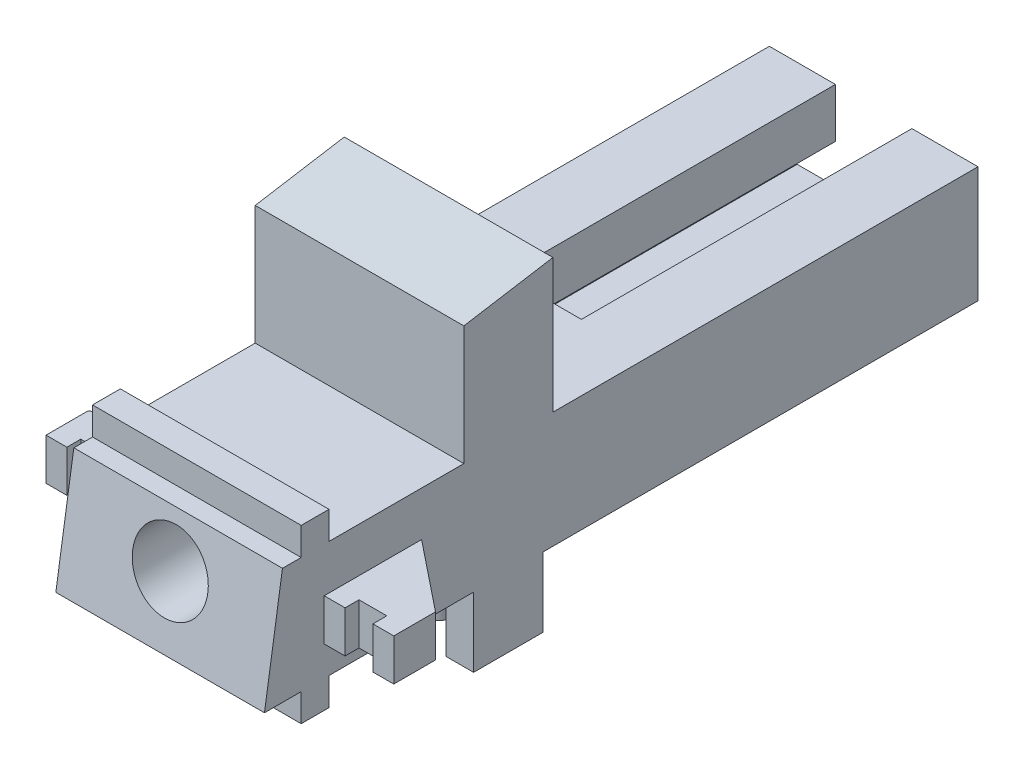
from build123d import *

# Parameters (mm, degrees)
SKETCH9_W               = 15
SKETCH9_H               = 8.35
BOSS_EXTRUDE4_DEPTH     = 50
CUT_EXTRUDE4_DEPTH      = 23.76
BOSS_EXTRUDE9_DEPTH     = 15
CUT_EXTRUDE5_REACH      = 31.734
SKETCH10_R              = 2.7
SKETCH12_W              = 3
SKETCH12_H              = 3
BOSS_EXTRUDE5_DEPTH     = 5
SKETCH13_W              = 2
SKETCH13_H              = 3
CUT_EXTRUDE6_DEPTH      = 1
BOSS_EXTRUDE6_DEPTH     = 3
SKETCH22_W              = 2
SKETCH22_H              = 2
BOSS_EXTRUDE10_DEPTH    = 15
CUT_EXTRUDE7_REACH      = 55.801
CUT_EXTRUDE7_END_RADIUS = 2.7
SKETCH23_R              = 2.5
SKETCH24_W              = 2
SKETCH24_H              = 5
BOSS_EXTRUDE11_DEPTH    = 5
BOSS_EXTRUDE12_DEPTH    = 15


with BuildPart() as part:
    # Sketch9 → Boss-Extrude4 (new body)
    with BuildSketch(Plane.XY):
        with Locations((0, 4.175)):
            Rectangle(SKETCH9_W, SKETCH9_H)
    extrude(amount=BOSS_EXTRUDE4_DEPTH)

    # Sketch7 → Cut-Extrude4 (cut)
    with BuildSketch(Plane.XY):
        Polygon((-5.5, 2), (-5.5, 4.8), (-2.75, 4.8), (-2.75, 8.35), (2.75, 8.35), (2.75, 4.8), (5.5, 4.8), (5.5, 2), align=None)
    extrude(amount=CUT_EXTRUDE4_DEPTH, mode=Mode.SUBTRACT)

    # Sketch21 → Boss-Extrude9 (add)
    with BuildSketch(Plane.ZY.offset(7.5)):
        Polygon((50, 0), (51.294730508, 0), (50, 8.35), align=None)
    extrude(amount=-BOSS_EXTRUDE9_DEPTH)

    # Cut-Extrude5: up to this plane
    cut_extrude5_end = Plane(origin=(15.949782665, 0, 51.294730508), z_dir=(0, 0.15322648630316937, 0.9881910968507989))
    # Sketch10 → Cut-Extrude5 (cut, up to the surface)
    with BuildSketch(Plane.XY.offset(23.76), mode=Mode.PRIVATE) as cut_extrude5_sk1:
        with Locations(Location((0, 4.7, 0), (0, 0, 270))):
            Circle(SKETCH10_R)
    cut_extrude5_tool1 = split(extrude(cut_extrude5_sk1.sketch, amount=CUT_EXTRUDE5_REACH, mode=Mode.PRIVATE), bisect_by=cut_extrude5_end, keep=Keep.BOTH, mode=Mode.PRIVATE)
    add(cut_extrude5_tool1.solids().sort_by_distance((0, 4.7, 23.76))[0], mode=Mode.SUBTRACT)

    # Sketch12 → Boss-Extrude5 (add)
    with BuildSketch(Plane(origin=(7.5, 0, 0), x_dir=(0, 0, -1), z_dir=(1, 0, 0))):
        with Locations((-45.5, 3.64)):
            Rectangle(SKETCH12_W, SKETCH12_H)
    boss_extrude5 = extrude(amount=BOSS_EXTRUDE5_DEPTH)

    # Sketch13 → Cut-Extrude6 (cut)
    with BuildSketch(Plane.XY.offset(47)):
        with Locations((10, 3.64)):
            Rectangle(SKETCH13_W, SKETCH13_H)
    cut_extrude6 = extrude(amount=-CUT_EXTRUDE6_DEPTH, mode=Mode.SUBTRACT)

    # Mirror2: Boss-Extrude5 across plane
    add(boss_extrude5.mirror(Plane(origin=(0, 0, 0), x_dir=(0, 0, 1), z_dir=(1, 0, 0))))

    # Mirror4: Cut-Extrude6 across plane
    add(cut_extrude6.mirror(Plane(origin=(0, 0, 0), x_dir=(0, 0, 1), z_dir=(1, 0, 0))), mode=Mode.SUBTRACT)

    # Sketch14 → Boss-Extrude6 (add)
    with BuildSketch(Plane(origin=(0, 5.14, 0), x_dir=(1, 0, 0), z_dir=(0, 1, 0))):
        Polygon((12.5, -44), (7.5, -40), (7.5, -44), align=None)
    boss_extrude6 = extrude(amount=-BOSS_EXTRUDE6_DEPTH)

    # Mirror5: Boss-Extrude6 across plane
    add(boss_extrude6.mirror(Plane(origin=(0, 0, 0), x_dir=(0, 0, 1), z_dir=(1, 0, 0))))

    # Sketch22 → Boss-Extrude10 (add)
    with BuildSketch(Plane.ZY.offset(7.5)):
        with Locations((47.655054804, -1)):
            Rectangle(SKETCH22_W, SKETCH22_H)
        with Locations((47.655054804, 9.35)):
            Rectangle(SKETCH22_W, SKETCH22_H)
    extrude(amount=-BOSS_EXTRUDE10_DEPTH)

    # Cut-Extrude7: up to this cylinder (the profile starts outside it)
    cut_extrude7_end = Plane(origin=(0, 4.7, 29.26), z_dir=(0, 0, -1)) * Cylinder(CUT_EXTRUDE7_END_RADIUS, 118.002, mode=Mode.PRIVATE)
    # Sketch23 → Cut-Extrude7 (cut, up to the surface)
    with BuildSketch(Plane.XZ, mode=Mode.PRIVATE) as cut_extrude7_sk1:
        with Locations(Location((0, 29.26, 0), (0, 0, 270))):
            Circle(SKETCH23_R)
    cut_extrude7_tool1 = extrude(cut_extrude7_sk1.sketch, amount=-CUT_EXTRUDE7_REACH, mode=Mode.PRIVATE) - cut_extrude7_end
    add(cut_extrude7_tool1.solids().sort_by_distance((0, 0, 29.26))[0], mode=Mode.SUBTRACT)

    # Sketch24 → Boss-Extrude11 (add)
    with BuildSketch(Plane.XZ):
        with Locations((6.5, 33.76)):
            Rectangle(SKETCH24_W, SKETCH24_H)
        with Locations((-6.5, 33.76)):
            Rectangle(SKETCH24_W, SKETCH24_H)
        with BuildLine():
            Line((2.5, 33.01), (-2.5, 33.01))
            ThreePointArc((-2.5, 33.01), (-3.25, 33.76), (-2.5, 34.51))
            Line((-2.5, 34.51), (2.5, 34.51))
            ThreePointArc((2.5, 34.51), (3.25, 33.76), (2.5, 33.01))
        make_face()
    extrude(amount=BOSS_EXTRUDE11_DEPTH)

    # Sketch25 → Boss-Extrude12 (add)
    with BuildSketch(Plane(origin=(7.5, 0, 0), x_dir=(0, 0, -1), z_dir=(1, 0, 0))):
        Polygon((-30.558938802, 8.35), (-36.961061198, 8.35), (-36.961061198, 16.922552294), (-30.558938802, 17.980397342), align=None)
    extrude(amount=-BOSS_EXTRUDE12_DEPTH)


solid = part.part
